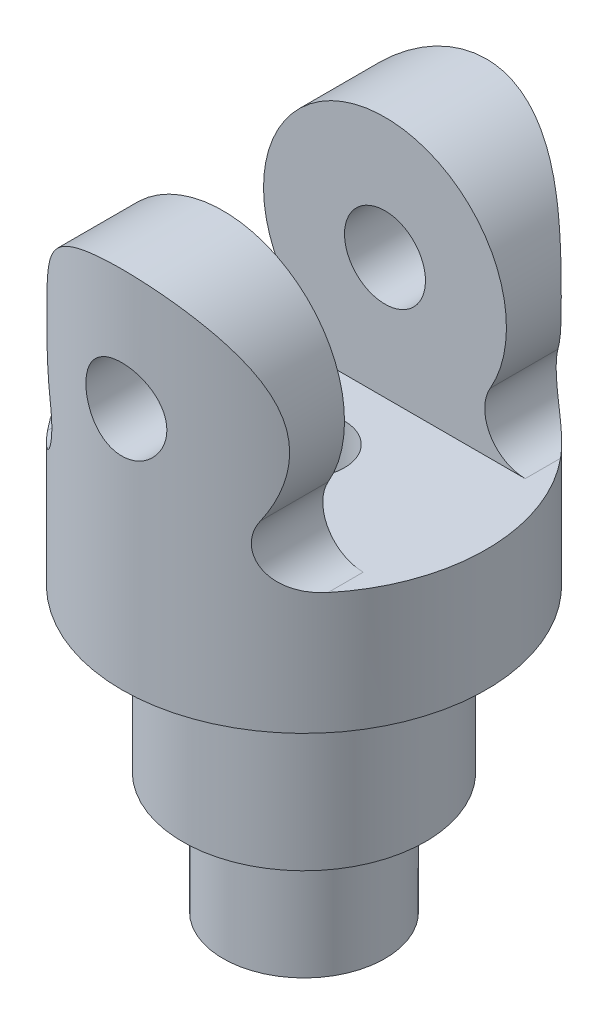
from build123d import *

# Parameters (mm, degrees)
CUT_EXTRUDE1_DEPTH      = 173.191753577
CUT_EXTRUDE2_DEPTH      = 173.191753722
CUT_EXTRUDE2_DEPTH_BACK = 173.191753722
SKETCH3_W               = 40
SKETCH3_H               = 60
CUT_EXTRUDE3_DEPTH      = 173.191753722
CUT_EXTRUDE3_DEPTH_BACK = 173.191753722
SKETCH5_R               = 10


with BuildPart() as part:
    # Sketch1 → Revolve1 (revolve)
    with BuildSketch(Plane.XY, mode=Mode.PRIVATE) as revolve1_sk:
        Polygon((10, 0), (20, 0), (20, 30), (30, 30), (30, 70), (45, 70), (45, 160), (10, 160), align=None)
    revolve(revolve1_sk.sketch.rotate(Axis((0, 0, 0), (0, 1, 0)), 90), axis=Axis((0, 0, 0), (0, 1, 0)))

    # Sketch2 → Cut-Extrude1 (cut, symmetric)
    with BuildSketch(Plane.XY):
        with BuildLine():
            Line((-34.641016151, 100), (-50, 100))
            Line((-50, 100), (-50, 160))
            Line((-50, 160), (0, 160))
            ThreePointArc((0, 160), (-25.980762114, 145), (-25.980762114, 115))
            ThreePointArc((-25.980762114, 115), (-25.980762114, 105), (-34.641016151, 100))
        make_face()
    cut_extrude1 = extrude(amount=CUT_EXTRUDE1_DEPTH, both=True, mode=Mode.SUBTRACT)

    # Mirror1: Cut-Extrude1 across plane
    add(cut_extrude1.mirror(Plane(origin=(0, 0, 0), x_dir=(0, 0, 1), z_dir=(1, 0, 0))), mode=Mode.SUBTRACT)

    # Sketch3 → Cut-Extrude2 (cut, two sides: drawn at the far end of the back side and taken through both)
    with BuildSketch(Plane(origin=(0, 0, 0), x_dir=(0, 0, -1), z_dir=(1, 0, 0)).offset(-CUT_EXTRUDE2_DEPTH_BACK)):
        with Locations((0, 130)):
            Rectangle(SKETCH3_W, SKETCH3_H)
    extrude(amount=CUT_EXTRUDE2_DEPTH + CUT_EXTRUDE2_DEPTH_BACK, mode=Mode.SUBTRACT)

    # Sketch5 → Cut-Extrude3 (cut, two sides: drawn at the far end of the back side and taken through both)
    with BuildSketch(Plane.XY.offset(-CUT_EXTRUDE3_DEPTH_BACK)):
        with Locations(Location((0, 130, 0), (0, 0, 90))):
            Circle(SKETCH5_R)
    extrude(amount=CUT_EXTRUDE3_DEPTH + CUT_EXTRUDE3_DEPTH_BACK, mode=Mode.SUBTRACT)


solid = part.part
